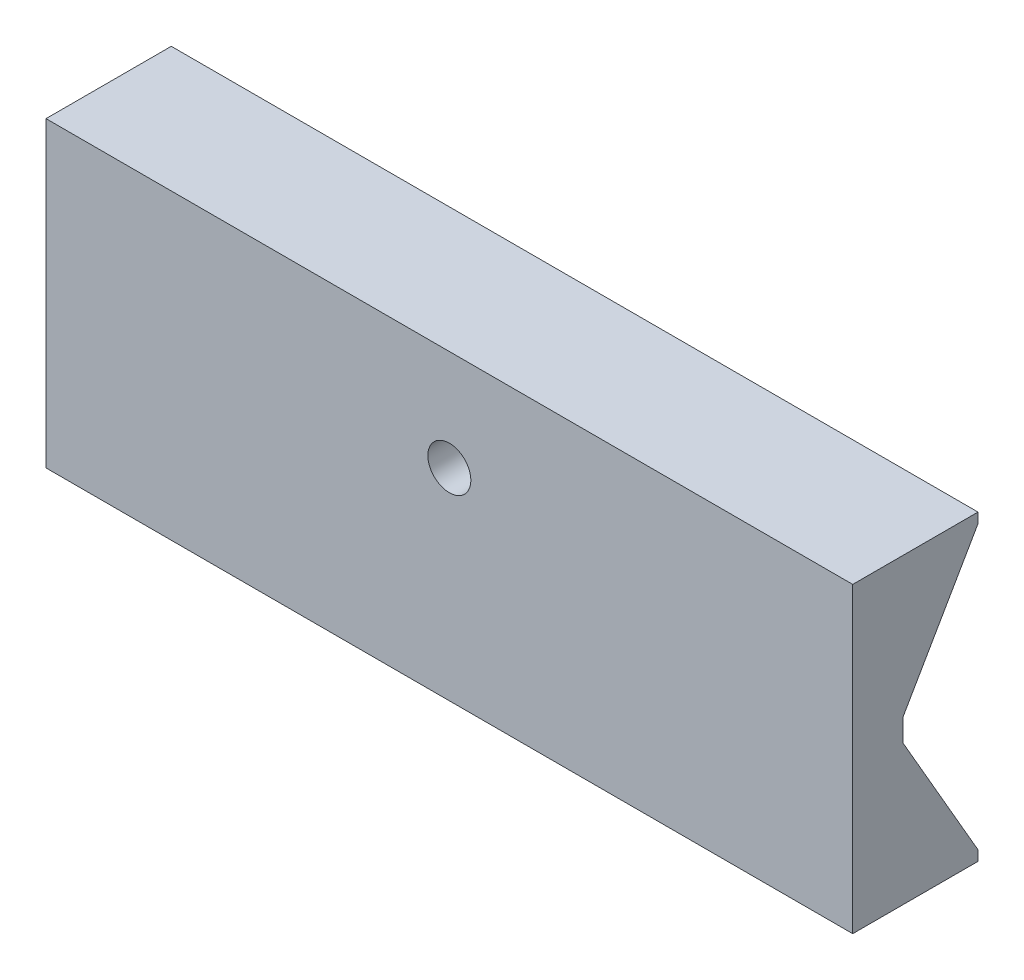
from build123d import *

# Parameters (mm, degrees)
BOSS_EXTRUDE1_DEPTH     = 101.6
F_1_4_28_TAPPED_HOLE1_D = 5.4102


with BuildPart() as part:
    # Sketch1 → Boss-Extrude1 (new body)
    with BuildSketch(Plane(origin=(0, 0, 0), x_dir=(0, 0, -1), z_dir=(1, 0, 0))):
        Polygon((0, 19.05), (0, -19.05), (15.776765158, -19.05), (15.776765158, -17.78), (6.35, -1.452363795), (6.35, 1.452363795), (15.776765158, 17.78), (15.776765158, 19.05), align=None)
    extrude(amount=BOSS_EXTRUDE1_DEPTH)

    # 1/4-28 Tapped Hole1 (through all)
    with Locations(Plane.XY):
        with Locations((50.8, 6.35)):
            Hole(F_1_4_28_TAPPED_HOLE1_D / 2)


solid = part.part
